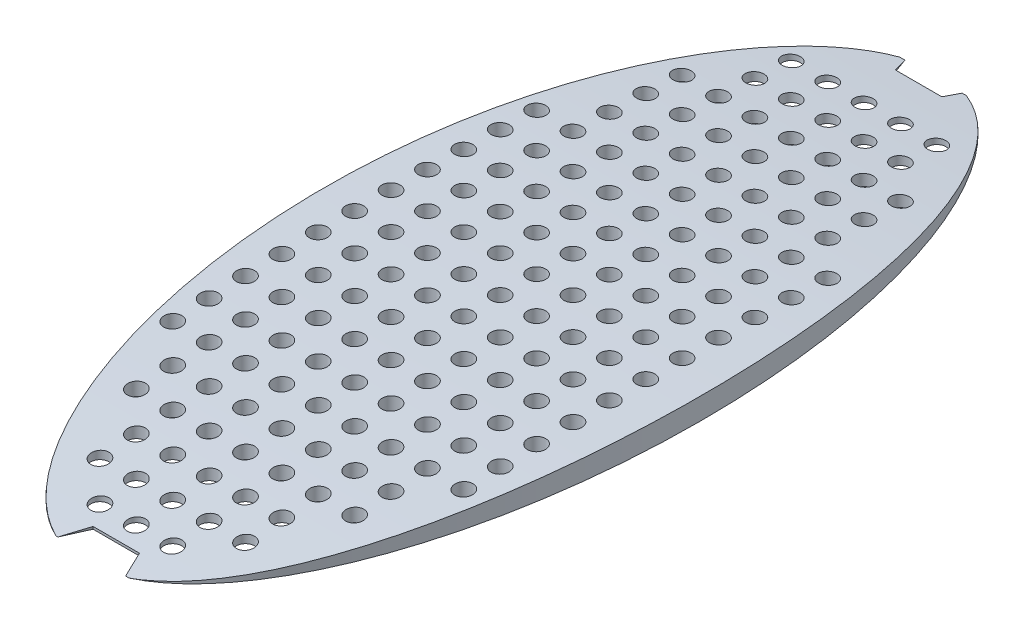
from build123d import *

# Parameters (mm, degrees)
SALIENTE_EXTRUIR1_DEPTH    = 10
CORTAR_EXTRUIR1_DEPTH      = 127.892313805
CORTAR_EXTRUIR1_DEPTH_BACK = 127.892313805
CROQUIS2_OUTSIDE_W         = 283.198
CROQUIS2_OUTSIDE_H         = 62.444
CORTAR_EXTRUIR2_DEPTH      = 127.301620393
CORTAR_EXTRUIR2_DEPTH_BACK = 127.301620393
CROQUIS3_R                 = 2.5


with BuildPart() as part:
    # Croquis1 → Saliente-Extruir1 (new body)
    with BuildSketch(Plane(origin=(0, 0, 0), x_dir=(1, 0, 0), z_dir=(0, 1, 0))):
        with BuildLine():
            Line((7.974439886, 110.672872924), (-4.779371862, 110.672872924))
            Line((-4.779371862, 110.672872924), (-6.420423638, 115.247430114))
            add(Edge.make_bspline(
                [(-6.420423638, 115.247430114), (-48.536731015, 99.943424097), (-49.733350951, 1.598755567), (-50.929970887, -96.745912962), (-9.226357852, -115.359349727)],
                knots=[3.30036347, 3.30036347, 3.30036347, 4.697851834, 4.697851834, 6.095340197, 6.095340197, 6.095340197], degree=2, weights=[1, 0.765650604, 1, 0.765650604, 1]))
            Line((-9.226357852, -115.359349727), (-6.153417184, -108.474392106))
            Line((-6.153417184, -108.474392106), (6.596582816, -108.474392106))
            Line((6.596582816, -108.474392106), (9.608265552, -115.507303946))
            add(Edge.make_bspline(
                [(9.608265552, -115.507303946), (51.57402315, -97.536433487), (51.572492659, 0.895581315), (51.570962168, 99.327596117), (9.604679114, 115.15085039)],
                knots=[0.186132543, 0.186132543, 0.186132543, 1.584412139, 1.584412139, 2.982691734, 2.982691734, 2.982691734], degree=2, weights=[1, 0.765396062, 1, 0.765396062, 1]))
            Line((9.604679114, 115.15085039), (7.974439886, 110.672872924))
        make_face()
    extrude(amount=SALIENTE_EXTRUIR1_DEPTH)

    # Croquis2 outside → Cortar-Extruir1 (cut, two sides: drawn at the far end of the back side and taken through both)
    with BuildSketch(Plane(origin=(0, 0, 0), x_dir=(0, 0, -1), z_dir=(1, 0, 0)).offset(-CORTAR_EXTRUIR1_DEPTH_BACK)):
        with Locations((-0.13, 5)):
            Rectangle(CROQUIS2_OUTSIDE_W, CROQUIS2_OUTSIDE_H)
        with BuildLine():
            Line((-115.139271801, 0), (114.744031743, 0))
            ThreePointArc((114.744031743, 0), (-0.197620029, 5.943514612), (-115.139271801, 0))
        make_face(mode=Mode.SUBTRACT)
    extrude(amount=CORTAR_EXTRUIR1_DEPTH + CORTAR_EXTRUIR1_DEPTH_BACK, mode=Mode.SUBTRACT)

    # Croquis3 → Cortar-Extruir2 (cut, two sides: drawn at the far end of the back side and taken through both)
    with BuildSketch(Plane.XZ.offset(-CORTAR_EXTRUIR2_DEPTH_BACK)):
        with Locations(Location((0, 102.736458156, 0), (0, 0, 270))):
            Circle(CROQUIS3_R)
        with Locations(Location((0, 92.736458156, 0), (0, 0, 270))):
            Circle(CROQUIS3_R)
        with Locations(Location((0, 82.736458156, 0), (0, 0, 270))):
            Circle(CROQUIS3_R)
        with Locations(Location((0, 72.736458156, 0), (0, 0, 270))):
            Circle(CROQUIS3_R)
        with Locations(Location((0, 62.736458156, 0), (0, 0, 270))):
            Circle(CROQUIS3_R)
        with Locations(Location((0, 52.736458156, 0), (0, 0, 270))):
            Circle(CROQUIS3_R)
        with Locations(Location((0, 42.736458156, 0), (0, 0, 270))):
            Circle(CROQUIS3_R)
        with Locations(Location((0, 32.736458156, 0), (0, 0, 270))):
            Circle(CROQUIS3_R)
        with Locations(Location((0, 22.736458156, 0), (0, 0, 270))):
            Circle(CROQUIS3_R)
        with Locations(Location((0, 12.736458156, 0), (0, 0, 270))):
            Circle(CROQUIS3_R)
        with Locations(Location((0, 2.736458156, 0), (0, 0, 270))):
            Circle(CROQUIS3_R)
        with Locations(Location((0, -7.263541844, 0), (0, 0, 270))):
            Circle(CROQUIS3_R)
        with Locations(Location((0, -17.263541844, 0), (0, 0, 270))):
            Circle(CROQUIS3_R)
        with Locations(Location((0, -27.263541844, 0), (0, 0, 270))):
            Circle(CROQUIS3_R)
        with Locations(Location((0, -37.263541844, 0), (0, 0, 270))):
            Circle(CROQUIS3_R)
        with Locations(Location((0, -47.263541844, 0), (0, 0, 270))):
            Circle(CROQUIS3_R)
        with Locations(Location((0, -57.263541844, 0), (0, 0, 270))):
            Circle(CROQUIS3_R)
        with Locations(Location((0, -67.263541844, 0), (0, 0, 270))):
            Circle(CROQUIS3_R)
        with Locations(Location((0, -77.263541844, 0), (0, 0, 270))):
            Circle(CROQUIS3_R)
        with Locations(Location((0, -87.263541844, 0), (0, 0, 270))):
            Circle(CROQUIS3_R)
        with Locations(Location((0, -97.263541844, 0), (0, 0, 270))):
            Circle(CROQUIS3_R)
        with Locations(Location((10, 92.736458156, 0), (0, 0, 270))):
            Circle(CROQUIS3_R)
        with Locations(Location((10, 82.736458156, 0), (0, 0, 270))):
            Circle(CROQUIS3_R)
        with Locations(Location((10, 72.736458156, 0), (0, 0, 270))):
            Circle(CROQUIS3_R)
        with Locations(Location((10, 62.736458156, 0), (0, 0, 270))):
            Circle(CROQUIS3_R)
        with Locations(Location((10, 52.736458156, 0), (0, 0, 270))):
            Circle(CROQUIS3_R)
        with Locations(Location((10, 42.736458156, 0), (0, 0, 270))):
            Circle(CROQUIS3_R)
        with Locations(Location((10, 32.736458156, 0), (0, 0, 270))):
            Circle(CROQUIS3_R)
        with Locations(Location((10, 22.736458156, 0), (0, 0, 270))):
            Circle(CROQUIS3_R)
        with Locations(Location((10, 12.736458156, 0), (0, 0, 270))):
            Circle(CROQUIS3_R)
        with Locations(Location((10, 2.736458156, 0), (0, 0, 270))):
            Circle(CROQUIS3_R)
        with Locations(Location((10, -7.263541844, 0), (0, 0, 270))):
            Circle(CROQUIS3_R)
        with Locations(Location((10, -17.263541844, 0), (0, 0, 270))):
            Circle(CROQUIS3_R)
        with Locations(Location((10, -27.263541844, 0), (0, 0, 270))):
            Circle(CROQUIS3_R)
        with Locations(Location((10, -37.263541844, 0), (0, 0, 270))):
            Circle(CROQUIS3_R)
        with Locations(Location((10, -47.263541844, 0), (0, 0, 270))):
            Circle(CROQUIS3_R)
        with Locations(Location((10, -57.263541844, 0), (0, 0, 270))):
            Circle(CROQUIS3_R)
        with Locations(Location((10, -67.263541844, 0), (0, 0, 270))):
            Circle(CROQUIS3_R)
        with Locations(Location((10, -77.263541844, 0), (0, 0, 270))):
            Circle(CROQUIS3_R)
        with Locations(Location((10, -87.263541844, 0), (0, 0, 270))):
            Circle(CROQUIS3_R)
        with Locations(Location((10, -97.263541844, 0), (0, 0, 270))):
            Circle(CROQUIS3_R)
        with Locations(Location((20, 92.736458156, 0), (0, 0, 270))):
            Circle(CROQUIS3_R)
        with Locations(Location((20, 82.736458156, 0), (0, 0, 270))):
            Circle(CROQUIS3_R)
        with Locations(Location((20, 72.736458156, 0), (0, 0, 270))):
            Circle(CROQUIS3_R)
        with Locations(Location((20, 62.736458156, 0), (0, 0, 270))):
            Circle(CROQUIS3_R)
        with Locations(Location((20, 52.736458156, 0), (0, 0, 270))):
            Circle(CROQUIS3_R)
        with Locations(Location((20, 42.736458156, 0), (0, 0, 270))):
            Circle(CROQUIS3_R)
        with Locations(Location((20, 32.736458156, 0), (0, 0, 270))):
            Circle(CROQUIS3_R)
        with Locations(Location((20, 22.736458156, 0), (0, 0, 270))):
            Circle(CROQUIS3_R)
        with Locations(Location((20, 12.736458156, 0), (0, 0, 270))):
            Circle(CROQUIS3_R)
        with Locations(Location((20, 2.736458156, 0), (0, 0, 270))):
            Circle(CROQUIS3_R)
        with Locations(Location((20, -7.263541844, 0), (0, 0, 270))):
            Circle(CROQUIS3_R)
        with Locations(Location((20, -17.263541844, 0), (0, 0, 270))):
            Circle(CROQUIS3_R)
        with Locations(Location((20, -27.263541844, 0), (0, 0, 270))):
            Circle(CROQUIS3_R)
        with Locations(Location((20, -37.263541844, 0), (0, 0, 270))):
            Circle(CROQUIS3_R)
        with Locations(Location((20, -47.263541844, 0), (0, 0, 270))):
            Circle(CROQUIS3_R)
        with Locations(Location((20, -57.263541844, 0), (0, 0, 270))):
            Circle(CROQUIS3_R)
        with Locations(Location((20, -67.263541844, 0), (0, 0, 270))):
            Circle(CROQUIS3_R)
        with Locations(Location((20, -77.263541844, 0), (0, 0, 270))):
            Circle(CROQUIS3_R)
        with Locations(Location((20, -87.263541844, 0), (0, 0, 270))):
            Circle(CROQUIS3_R)
        with Locations(Location((20, -97.263541844, 0), (0, 0, 270))):
            Circle(CROQUIS3_R)
        with Locations(Location((30, 72.736458156, 0), (0, 0, 270))):
            Circle(CROQUIS3_R)
        with Locations(Location((30, 62.736458156, 0), (0, 0, 270))):
            Circle(CROQUIS3_R)
        with Locations(Location((30, 52.736458156, 0), (0, 0, 270))):
            Circle(CROQUIS3_R)
        with Locations(Location((30, 42.736458156, 0), (0, 0, 270))):
            Circle(CROQUIS3_R)
        with Locations(Location((30, 32.736458156, 0), (0, 0, 270))):
            Circle(CROQUIS3_R)
        with Locations(Location((30, 22.736458156, 0), (0, 0, 270))):
            Circle(CROQUIS3_R)
        with Locations(Location((30, 12.736458156, 0), (0, 0, 270))):
            Circle(CROQUIS3_R)
        with Locations(Location((30, 2.736458156, 0), (0, 0, 270))):
            Circle(CROQUIS3_R)
        with Locations(Location((30, -7.263541844, 0), (0, 0, 270))):
            Circle(CROQUIS3_R)
        with Locations(Location((30, -17.263541844, 0), (0, 0, 270))):
            Circle(CROQUIS3_R)
        with Locations(Location((30, -27.263541844, 0), (0, 0, 270))):
            Circle(CROQUIS3_R)
        with Locations(Location((30, -37.263541844, 0), (0, 0, 270))):
            Circle(CROQUIS3_R)
        with Locations(Location((30, -47.263541844, 0), (0, 0, 270))):
            Circle(CROQUIS3_R)
        with Locations(Location((30, -57.263541844, 0), (0, 0, 270))):
            Circle(CROQUIS3_R)
        with Locations(Location((30, -67.263541844, 0), (0, 0, 270))):
            Circle(CROQUIS3_R)
        with Locations(Location((30, -77.263541844, 0), (0, 0, 270))):
            Circle(CROQUIS3_R)
        with Locations(Location((40, 52.736458156, 0), (0, 0, 270))):
            Circle(CROQUIS3_R)
        with Locations(Location((40, 42.736458156, 0), (0, 0, 270))):
            Circle(CROQUIS3_R)
        with Locations(Location((40, 32.736458156, 0), (0, 0, 270))):
            Circle(CROQUIS3_R)
        with Locations(Location((40, 22.736458156, 0), (0, 0, 270))):
            Circle(CROQUIS3_R)
        with Locations(Location((40, 12.736458156, 0), (0, 0, 270))):
            Circle(CROQUIS3_R)
        with Locations(Location((40, 2.736458156, 0), (0, 0, 270))):
            Circle(CROQUIS3_R)
        with Locations(Location((40, -7.263541844, 0), (0, 0, 270))):
            Circle(CROQUIS3_R)
        with Locations(Location((40, -17.263541844, 0), (0, 0, 270))):
            Circle(CROQUIS3_R)
        with Locations(Location((40, -27.263541844, 0), (0, 0, 270))):
            Circle(CROQUIS3_R)
        with Locations(Location((40, -37.263541844, 0), (0, 0, 270))):
            Circle(CROQUIS3_R)
        with Locations(Location((40, -47.263541844, 0), (0, 0, 270))):
            Circle(CROQUIS3_R)
        with Locations(Location((10, 102.736458156, 0), (0, 0, 270))):
            Circle(CROQUIS3_R)
        with Locations(Location((-10, 102.736458156, 0), (0, 0, 270))):
            Circle(CROQUIS3_R)
        with Locations(Location((-40, -47.263541844, 0), (0, 0, 270))):
            Circle(CROQUIS3_R)
        with Locations(Location((-40, -37.263541844, 0), (0, 0, 270))):
            Circle(CROQUIS3_R)
        with Locations(Location((-40, -27.263541844, 0), (0, 0, 270))):
            Circle(CROQUIS3_R)
        with Locations(Location((-40, -17.263541844, 0), (0, 0, 270))):
            Circle(CROQUIS3_R)
        with Locations(Location((-40, -7.263541844, 0), (0, 0, 270))):
            Circle(CROQUIS3_R)
        with Locations(Location((-40, 2.736458156, 0), (0, 0, 270))):
            Circle(CROQUIS3_R)
        with Locations(Location((-40, 12.736458156, 0), (0, 0, 270))):
            Circle(CROQUIS3_R)
        with Locations(Location((-40, 22.736458156, 0), (0, 0, 270))):
            Circle(CROQUIS3_R)
        with Locations(Location((-40, 32.736458156, 0), (0, 0, 270))):
            Circle(CROQUIS3_R)
        with Locations(Location((-40, 42.736458156, 0), (0, 0, 270))):
            Circle(CROQUIS3_R)
        with Locations(Location((-40, 52.736458156, 0), (0, 0, 270))):
            Circle(CROQUIS3_R)
        with Locations(Location((-30, -77.263541844, 0), (0, 0, 270))):
            Circle(CROQUIS3_R)
        with Locations(Location((-30, -67.263541844, 0), (0, 0, 270))):
            Circle(CROQUIS3_R)
        with Locations(Location((-30, -57.263541844, 0), (0, 0, 270))):
            Circle(CROQUIS3_R)
        with Locations(Location((-30, -47.263541844, 0), (0, 0, 270))):
            Circle(CROQUIS3_R)
        with Locations(Location((-30, -37.263541844, 0), (0, 0, 270))):
            Circle(CROQUIS3_R)
        with Locations(Location((-30, -27.263541844, 0), (0, 0, 270))):
            Circle(CROQUIS3_R)
        with Locations(Location((-30, -17.263541844, 0), (0, 0, 270))):
            Circle(CROQUIS3_R)
        with Locations(Location((-30, -7.263541844, 0), (0, 0, 270))):
            Circle(CROQUIS3_R)
        with Locations(Location((-30, 2.736458156, 0), (0, 0, 270))):
            Circle(CROQUIS3_R)
        with Locations(Location((-30, 12.736458156, 0), (0, 0, 270))):
            Circle(CROQUIS3_R)
        with Locations(Location((-30, 22.736458156, 0), (0, 0, 270))):
            Circle(CROQUIS3_R)
        with Locations(Location((-30, 32.736458156, 0), (0, 0, 270))):
            Circle(CROQUIS3_R)
        with Locations(Location((-30, 42.736458156, 0), (0, 0, 270))):
            Circle(CROQUIS3_R)
        with Locations(Location((-30, 52.736458156, 0), (0, 0, 270))):
            Circle(CROQUIS3_R)
        with Locations(Location((-30, 62.736458156, 0), (0, 0, 270))):
            Circle(CROQUIS3_R)
        with Locations(Location((-30, 72.736458156, 0), (0, 0, 270))):
            Circle(CROQUIS3_R)
        with Locations(Location((-20, -97.263541844, 0), (0, 0, 270))):
            Circle(CROQUIS3_R)
        with Locations(Location((-20, -87.263541844, 0), (0, 0, 270))):
            Circle(CROQUIS3_R)
        with Locations(Location((-20, -77.263541844, 0), (0, 0, 270))):
            Circle(CROQUIS3_R)
        with Locations(Location((-20, -67.263541844, 0), (0, 0, 270))):
            Circle(CROQUIS3_R)
        with Locations(Location((-20, -57.263541844, 0), (0, 0, 270))):
            Circle(CROQUIS3_R)
        with Locations(Location((-20, -47.263541844, 0), (0, 0, 270))):
            Circle(CROQUIS3_R)
        with Locations(Location((-20, -37.263541844, 0), (0, 0, 270))):
            Circle(CROQUIS3_R)
        with Locations(Location((-20, -27.263541844, 0), (0, 0, 270))):
            Circle(CROQUIS3_R)
        with Locations(Location((-20, -17.263541844, 0), (0, 0, 270))):
            Circle(CROQUIS3_R)
        with Locations(Location((-20, -7.263541844, 0), (0, 0, 270))):
            Circle(CROQUIS3_R)
        with Locations(Location((-20, 2.736458156, 0), (0, 0, 270))):
            Circle(CROQUIS3_R)
        with Locations(Location((-20, 12.736458156, 0), (0, 0, 270))):
            Circle(CROQUIS3_R)
        with Locations(Location((-20, 22.736458156, 0), (0, 0, 270))):
            Circle(CROQUIS3_R)
        with Locations(Location((-20, 32.736458156, 0), (0, 0, 270))):
            Circle(CROQUIS3_R)
        with Locations(Location((-20, 42.736458156, 0), (0, 0, 270))):
            Circle(CROQUIS3_R)
        with Locations(Location((-20, 52.736458156, 0), (0, 0, 270))):
            Circle(CROQUIS3_R)
        with Locations(Location((-20, 62.736458156, 0), (0, 0, 270))):
            Circle(CROQUIS3_R)
        with Locations(Location((-20, 72.736458156, 0), (0, 0, 270))):
            Circle(CROQUIS3_R)
        with Locations(Location((-20, 82.736458156, 0), (0, 0, 270))):
            Circle(CROQUIS3_R)
        with Locations(Location((-20, 92.736458156, 0), (0, 0, 270))):
            Circle(CROQUIS3_R)
        with Locations(Location((-10, -97.263541844, 0), (0, 0, 270))):
            Circle(CROQUIS3_R)
        with Locations(Location((-10, -87.263541844, 0), (0, 0, 270))):
            Circle(CROQUIS3_R)
        with Locations(Location((-10, -77.263541844, 0), (0, 0, 270))):
            Circle(CROQUIS3_R)
        with Locations(Location((-10, -67.263541844, 0), (0, 0, 270))):
            Circle(CROQUIS3_R)
        with Locations(Location((-10, -57.263541844, 0), (0, 0, 270))):
            Circle(CROQUIS3_R)
        with Locations(Location((-10, -47.263541844, 0), (0, 0, 270))):
            Circle(CROQUIS3_R)
        with Locations(Location((-10, -37.263541844, 0), (0, 0, 270))):
            Circle(CROQUIS3_R)
        with Locations(Location((-10, -27.263541844, 0), (0, 0, 270))):
            Circle(CROQUIS3_R)
        with Locations(Location((-10, -17.263541844, 0), (0, 0, 270))):
            Circle(CROQUIS3_R)
        with Locations(Location((-10, -7.263541844, 0), (0, 0, 270))):
            Circle(CROQUIS3_R)
        with Locations(Location((-10, 2.736458156, 0), (0, 0, 270))):
            Circle(CROQUIS3_R)
        with Locations(Location((-10, 12.736458156, 0), (0, 0, 270))):
            Circle(CROQUIS3_R)
        with Locations(Location((-10, 22.736458156, 0), (0, 0, 270))):
            Circle(CROQUIS3_R)
        with Locations(Location((-10, 32.736458156, 0), (0, 0, 270))):
            Circle(CROQUIS3_R)
        with Locations(Location((-10, 42.736458156, 0), (0, 0, 270))):
            Circle(CROQUIS3_R)
        with Locations(Location((-10, 52.736458156, 0), (0, 0, 270))):
            Circle(CROQUIS3_R)
        with Locations(Location((-10, 62.736458156, 0), (0, 0, 270))):
            Circle(CROQUIS3_R)
        with Locations(Location((-10, 72.736458156, 0), (0, 0, 270))):
            Circle(CROQUIS3_R)
        with Locations(Location((-10, 82.736458156, 0), (0, 0, 270))):
            Circle(CROQUIS3_R)
        with Locations(Location((-10, 92.736458156, 0), (0, 0, 270))):
            Circle(CROQUIS3_R)
    extrude(amount=CORTAR_EXTRUIR2_DEPTH + CORTAR_EXTRUIR2_DEPTH_BACK, mode=Mode.SUBTRACT)


solid = part.part
